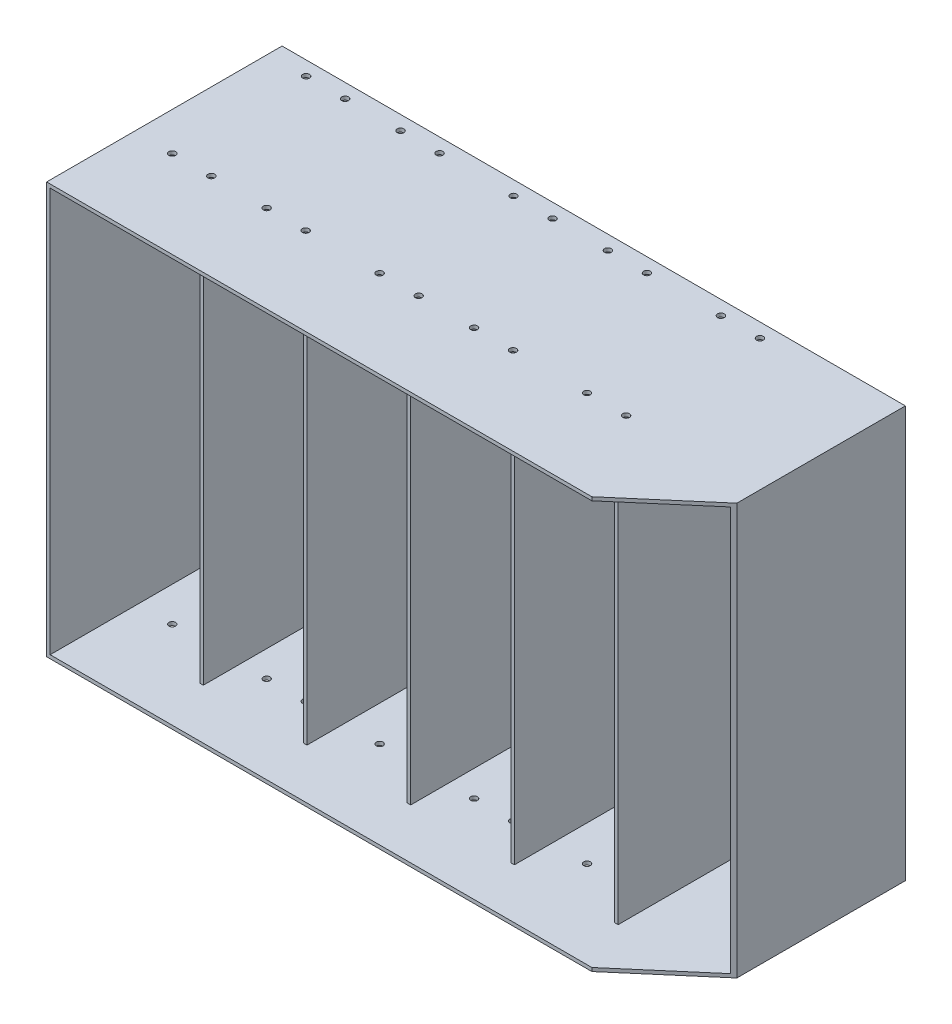
from build123d import *

# Parameters (mm, degrees)
SKETCH1_W           = 558.8
SKETCH1_H           = 368.6625
SKETCH1_W_2         = 552.45
SKETCH1_H_2         = 362.3125
SKETCH1_W_3         = 3.175
SKETCH1_W_4         = 89.789
SKETCH1_W_5         = 89.15625
SKETCH1_W_6         = 88.26275
BOSS_EXTRUDE1_DEPTH = 3.175
SKETCH2_W           = 558.8
SKETCH2_H           = 368.6625
SKETCH2_W_2         = 552.45
SKETCH2_H_2         = 362.3125
SKETCH2_W_3         = 3.175
BOSS_EXTRUDE2_DEPTH = 162.9
SKETCH3_W           = 558.8
SKETCH3_H           = 368.6625
BOSS_EXTRUDE3_DEPTH = 45
CUT_EXTRUDE1_DEPTH  = 509.457524805
SKETCH5_R           = 3
CUT_EXTRUDE2_DEPTH  = 509.457524805
LPATTERN1_COUNT     = 3
LPATTERN1_PITCH     = 185.928
SKETCH6_R           = 3
CUT_EXTRUDE3_DEPTH  = 509.457524805
LPATTERN2_COUNT     = 2
LPATTERN2_PITCH     = 185.928


with BuildPart() as part:
    # Sketch1 → Boss-Extrude1 (new body)
    # profile 1 of 12: a face of its own
    with BuildSketch(Plane.XY):
        Rectangle(SKETCH1_W, SKETCH1_H)
        Rectangle(SKETCH1_W_2, SKETCH1_H_2, mode=Mode.SUBTRACT)
    # profile 2 of 12: a face of its own
    with BuildSketch(Plane.XY):
        with Locations((-185.48125, 0)):
            Rectangle(SKETCH1_W_3, SKETCH1_H_2)
    # profile 3 of 12: a face of its own
    with BuildSketch(Plane.XY):
        with Locations((-138.99925, 0)):
            Rectangle(SKETCH1_W_4, SKETCH1_H_2)
    # profile 4 of 12: a face of its own
    with BuildSketch(Plane.XY):
        with Locations((-231.646875, 0)):
            Rectangle(SKETCH1_W_5, SKETCH1_H_2)
    # profile 5 of 12: a face of its own
    with BuildSketch(Plane.XY):
        with Locations((-46.03525, 0)):
            Rectangle(SKETCH1_W_4, SKETCH1_H_2)
    # profile 6 of 12: a face of its own
    with BuildSketch(Plane.XY):
        with Locations((-92.51725, 0)):
            Rectangle(SKETCH1_W_3, SKETCH1_H_2)
    # profile 7 of 12: a face of its own
    with BuildSketch(Plane.XY):
        with Locations((46.92875, 0)):
            Rectangle(SKETCH1_W_4, SKETCH1_H_2)
    # profile 8 of 12: a face of its own
    with BuildSketch(Plane.XY):
        with Locations((0.44675, 0)):
            Rectangle(SKETCH1_W_3, SKETCH1_H_2)
    # profile 9 of 12: a face of its own
    with BuildSketch(Plane.XY):
        with Locations((139.89275, 0)):
            Rectangle(SKETCH1_W_4, SKETCH1_H_2)
    # profile 10 of 12: a face of its own
    with BuildSketch(Plane.XY):
        with Locations((93.41075, 0)):
            Rectangle(SKETCH1_W_3, SKETCH1_H_2)
    # profile 11 of 12: a face of its own
    with BuildSketch(Plane.XY):
        with Locations((232.093625, 0)):
            Rectangle(SKETCH1_W_6, SKETCH1_H_2)
    # profile 12 of 12: a face of its own
    with BuildSketch(Plane.XY):
        with Locations((186.37475, 0)):
            Rectangle(SKETCH1_W_3, SKETCH1_H_2)
    extrude(amount=BOSS_EXTRUDE1_DEPTH)

    # Sketch2 → Boss-Extrude2 (add)
    # profile 1 of 6: a face of its own
    with BuildSketch(Plane.XY.offset(3.175)):
        Rectangle(SKETCH2_W, SKETCH2_H)
        Rectangle(SKETCH2_W_2, SKETCH2_H_2, mode=Mode.SUBTRACT)
    # profile 2 of 6: a face of its own
    with BuildSketch(Plane.XY.offset(3.175)):
        with Locations((-185.48125, 0)):
            Rectangle(SKETCH2_W_3, SKETCH2_H_2)
    # profile 3 of 6: a face of its own
    with BuildSketch(Plane.XY.offset(3.175)):
        with Locations((-92.51725, 0)):
            Rectangle(SKETCH2_W_3, SKETCH2_H_2)
    # profile 4 of 6: a face of its own
    with BuildSketch(Plane.XY.offset(3.175)):
        with Locations((0.44675, 0)):
            Rectangle(SKETCH2_W_3, SKETCH2_H_2)
    # profile 5 of 6: a face of its own
    with BuildSketch(Plane.XY.offset(3.175)):
        with Locations((93.41075, 0)):
            Rectangle(SKETCH2_W_3, SKETCH2_H_2)
    # profile 6 of 6: a face of its own
    with BuildSketch(Plane.XY.offset(3.175)):
        with Locations((186.37475, 0)):
            Rectangle(SKETCH2_W_3, SKETCH2_H_2)
    extrude(amount=BOSS_EXTRUDE2_DEPTH)

    # Sketch3 → Boss-Extrude3 (add)
    with BuildSketch(Plane.XY.offset(166.075)):
        Rectangle(SKETCH3_W, SKETCH3_H)
        Polygon((187.96225, 181.15625), (276.225, 181.15625), (276.225, -181.15625), (187.96225, -181.15625), (184.78725, -181.15625), (94.99825, -181.15625), (91.82325, -181.15625), (2.03425, -181.15625), (-1.14075, -181.15625), (-90.92975, -181.15625), (-94.10475, -181.15625), (-183.89375, -181.15625), (-187.06875, -181.15625), (-276.225, -181.15625), (-276.225, 181.15625), (-187.06875, 181.15625), (-183.89375, 181.15625), (-94.10475, 181.15625), (-90.92975, 181.15625), (-1.14075, 181.15625), (2.03425, 181.15625), (91.82325, 181.15625), (94.99825, 181.15625), (184.78725, 181.15625), align=None, mode=Mode.SUBTRACT)
    extrude(amount=BOSS_EXTRUDE3_DEPTH)

    # Sketch4 → Cut-Extrude1 (cut, through all)
    with BuildSketch(Plane.XZ.offset(184.33125)):
        Polygon((279.4, 211.075), (209.4, 211.075), (279.4, 151.075), align=None)
    extrude(amount=-CUT_EXTRUDE1_DEPTH, mode=Mode.SUBTRACT)

    # Sketch5 → Cut-Extrude2 (cut, through all)
    with BuildSketch(Plane.XZ.offset(184.33125)):
        with Locations(Location((-210.146875, 12.7, 0), (0, 0, 270))):
            Circle(SKETCH5_R)
        with Locations(Location((-245.146875, 12.7, 0), (0, 0, 270))):
            Circle(SKETCH5_R)
        with Locations(Location((-210.146875, 132.7, 0), (0, 0, 270))):
            Circle(SKETCH5_R)
        with Locations(Location((-245.146875, 132.7, 0), (0, 0, 270))):
            Circle(SKETCH5_R)
    cut_extrude2 = extrude(amount=-CUT_EXTRUDE2_DEPTH, mode=Mode.SUBTRACT)

    # LPattern1: Cut-Extrude2 ×3
    with Locations(*[(i * LPATTERN1_PITCH, 0, 0) for i in range(1, LPATTERN1_COUNT)]):
        add(cut_extrude2, mode=Mode.SUBTRACT)

    # Sketch6 → Cut-Extrude3 (cut, through all)
    with BuildSketch(Plane.XZ.offset(184.33125)):
        with Locations(Location((-125.49925, 132.7, 0), (0, 0, 270))):
            Circle(SKETCH6_R)
        with Locations(Location((-160.49925, 132.7, 0), (0, 0, 270))):
            Circle(SKETCH6_R)
        with Locations(Location((-125.49925, 12.7, 0), (0, 0, 270))):
            Circle(SKETCH6_R)
        with Locations(Location((-160.49925, 12.7, 0), (0, 0, 270))):
            Circle(SKETCH6_R)
    cut_extrude3 = extrude(amount=-CUT_EXTRUDE3_DEPTH, mode=Mode.SUBTRACT)

    # LPattern2: Cut-Extrude3 ×2
    with Locations(*[(i * LPATTERN2_PITCH, 0, 0) for i in range(1, LPATTERN2_COUNT)]):
        add(cut_extrude3, mode=Mode.SUBTRACT)


solid = part.part
